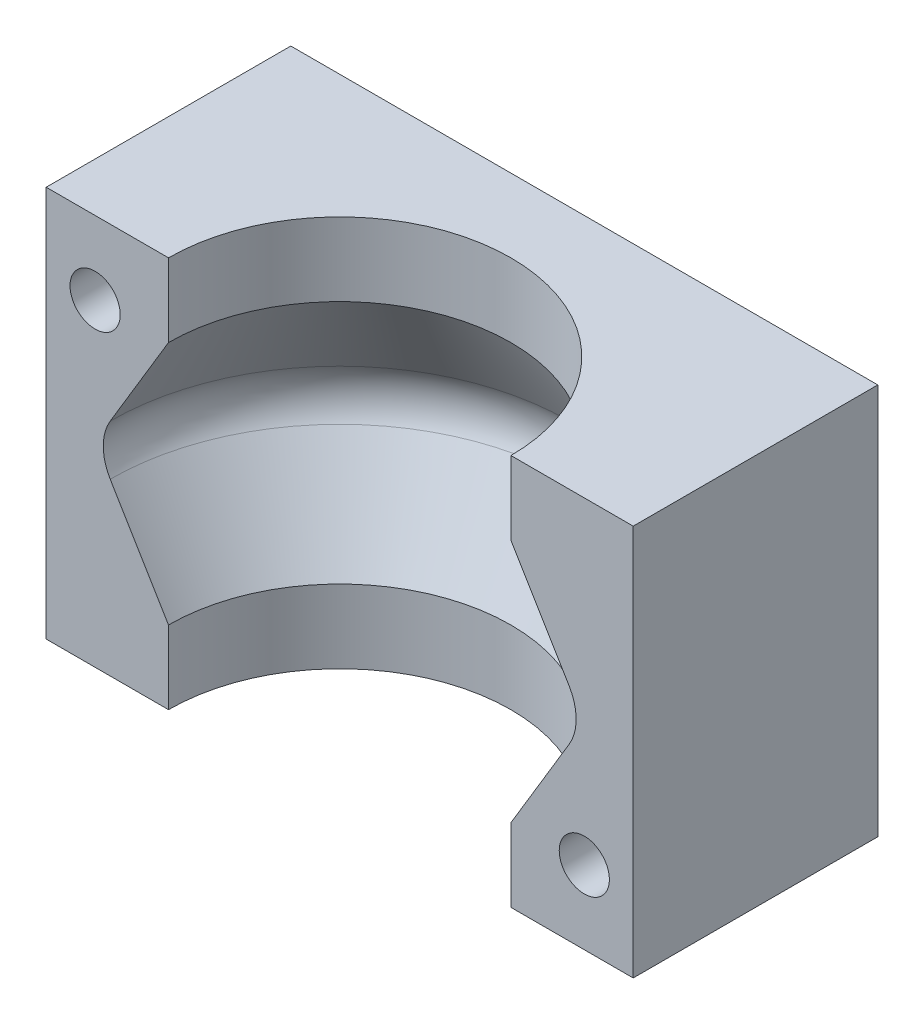
from build123d import *

# Parameters (mm, degrees)
SKETCH1_W           = 120
SKETCH1_H           = 80
BOSS_EXTRUDE1_DEPTH = 50
SKETCH3_R           = 5.125
CUT_EXTRUDE1_DEPTH  = 10.2


with BuildPart() as part:
    # Sketch1 → Boss-Extrude1 (new body)
    with BuildSketch(Plane.XY):
        Rectangle(SKETCH1_W, SKETCH1_H)
    extrude(amount=BOSS_EXTRUDE1_DEPTH)

    # Sketch3 → Cut-Extrude1 (cut)
    with BuildSketch(Plane.XY.offset(50)):
        with Locations(Location((-50, 25, 0), (0, 0, 180))):
            Circle(SKETCH3_R)
        with Locations(Location((50, -25, 0), (0, 0, 180))):
            Circle(SKETCH3_R)
    extrude(amount=-CUT_EXTRUDE1_DEPTH, mode=Mode.SUBTRACT)

    # Sketch2 → Cut-Revolve1 (revolve, cut)
    with BuildSketch(Plane.XY.offset(50)):
        with BuildLine():
            Line((-35, 40), (-35, 25))
            Line((-35, 25), (-46.913025467, 5.144957554))
            ThreePointArc((-46.913025467, 5.144957554), (-48.33809621, 0), (-46.913025467, -5.144957554))
            Line((-46.913025467, -5.144957554), (-35, -25))
            Line((-35, -25), (-35, -40))
            Line((-35, -40), (0, -40))
            Line((0, -40), (0, 40))
            Line((0, 40), (-35, 40))
        make_face()
    revolve(axis=Axis((0, 40, 50), (0, -1, 0)), mode=Mode.SUBTRACT)


solid = part.part
